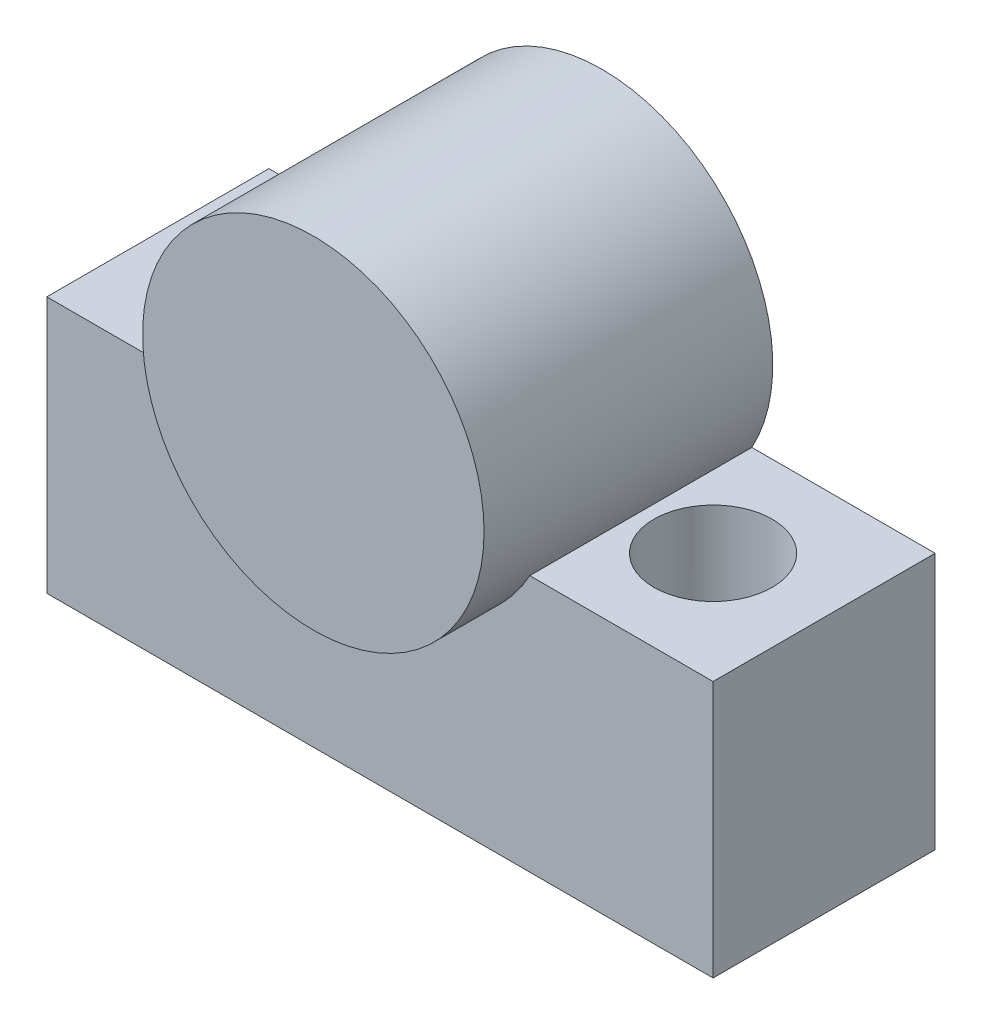
from build123d import *

# Parameters (mm, degrees)
SKETCH1_R                          = 2.38125
BOSS_EXTRUDE1_DEPTH                = 5.08
SKETCH2_R                          = 3.90525
BOSS_EXTRUDE2_DEPTH                = 1.524
TAP_DRILL_FOR_6_32_TAP1_AT_2_COUNT = 2
TAP_DRILL_FOR_6_32_TAP1_AT_2_PITCH = 10.16
SKETCH6_W                          = 15.24
SKETCH6_H                          = 5.08
SKETCH6_R                          = 1.35255
BOSS_EXTRUDE3_DEPTH                = 3.84175


with BuildPart() as part:
    # Sketch1 → Boss-Extrude1 (new body)
    with BuildSketch(Plane.XY):
        with BuildLine():
            Line((0, -3.90525), (-7.62, -3.90525))
            Line((-7.62, -3.90525), (-7.62, -1.87325))
            Line((-7.62, -1.87325), (-3.426647341, -1.87325))
            ThreePointArc((-3.426647341, -1.87325), (0, 3.90525), (3.426647341, -1.87325))
            Line((3.426647341, -1.87325), (7.62, -1.87325))
            Line((7.62, -1.87325), (7.62, -3.90525))
            Line((7.62, -3.90525), (0, -3.90525))
        make_face()
        Circle(SKETCH1_R, mode=Mode.SUBTRACT)
    extrude(amount=BOSS_EXTRUDE1_DEPTH)

    # Sketch2 → Boss-Extrude2 (add)
    with BuildSketch(Plane.XY.offset(5.08)):
        with Locations(Location((0, 0, 0), (0, 0, 208.664164633))):
            Circle(SKETCH2_R)
    extrude(amount=BOSS_EXTRUDE2_DEPTH)

    # Sketch4 → Tap Drill for #6-32 Tap1 (revolve, cut)
    with BuildSketch(Plane(origin=(-5.08, -1.87325, 2.54), x_dir=(0, 0, 1), z_dir=(1, 0, 0))):
        Polygon((0, 0), (0, 8.43269403), (1.35255, 7.62), (1.35255, 0), align=None)
    tap_drill_for_6_32_tap1 = revolve(axis=Axis((-5.08, 4.47675, 2.54), (0, -1, 0)), mode=Mode.SUBTRACT)

    # Tap Drill for #6-32 Tap1 at 2: Tap Drill for #6-32 Tap1 ×2
    with Locations(*[(i * TAP_DRILL_FOR_6_32_TAP1_AT_2_PITCH, 0, 0) for i in range(1, TAP_DRILL_FOR_6_32_TAP1_AT_2_COUNT)]):
        add(tap_drill_for_6_32_tap1, mode=Mode.SUBTRACT)

    # Sketch6 → Boss-Extrude3 (add)
    with BuildSketch(Plane.XZ.offset(3.90525)):
        with Locations((0, 2.54)):
            Rectangle(SKETCH6_W, SKETCH6_H)
        with Locations(Location((-5.08, 2.54, 0), (0, 0, 90))):
            Circle(SKETCH6_R, mode=Mode.SUBTRACT)
        with Locations(Location((5.08, 2.54, 0), (0, 0, 90))):
            Circle(SKETCH6_R, mode=Mode.SUBTRACT)
    extrude(amount=BOSS_EXTRUDE3_DEPTH)


solid = part.part
